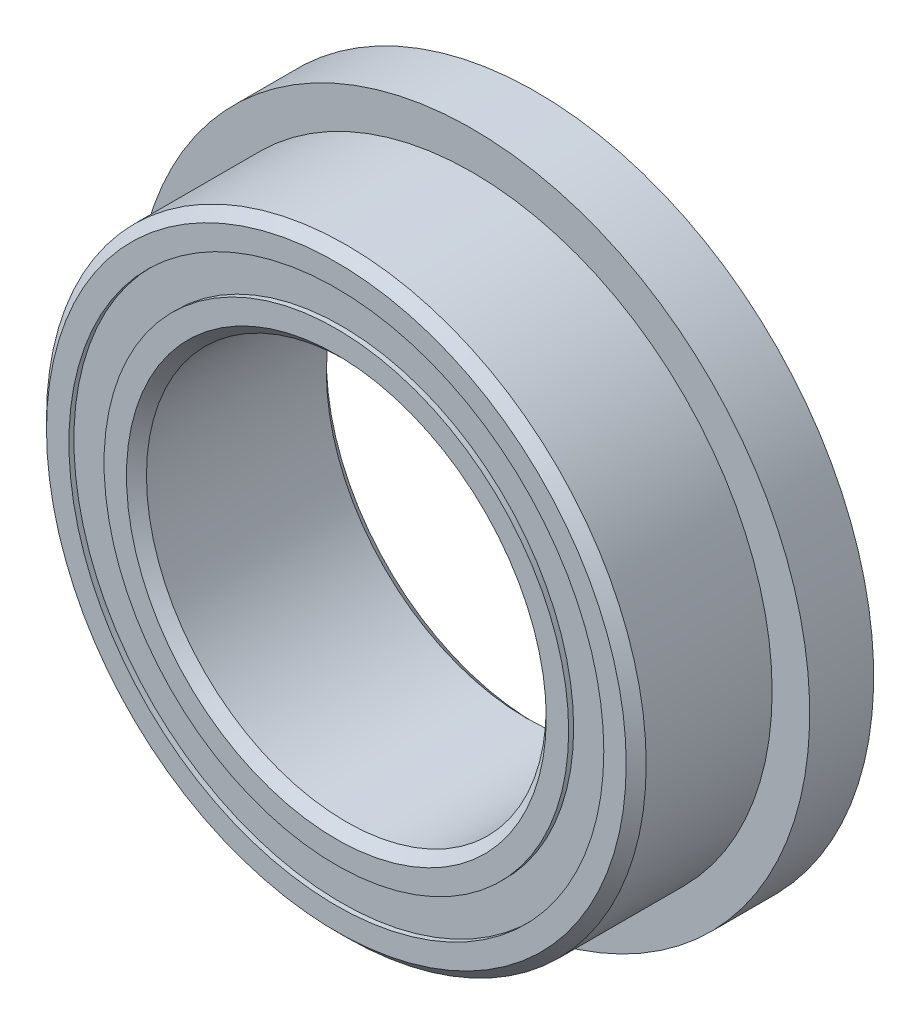
from build123d import *

# Parameters (mm, degrees)
CIRPATTERN1_COUNT = 14
SKETCH5_W         = 0.749364756
SKETCH5_H         = 0.558241758
SKETCH6_W         = 1.016
SKETCH6_H         = 1.111529121


with BuildPart() as part:
    # Sketch → Revolve1 (revolve)
    with BuildSketch(Plane(origin=(0, 0, 0), x_dir=(0, 0, -1), z_dir=(1, 0, 0))):
        with BuildLine():
            Line((1.42875, 4.7625), (-1.42875, 4.7625))
            Line((-1.42875, 4.7625), (-1.5875, 4.60375))
            Line((-1.5875, 4.60375), (-1.5875, 4.247870879))
            Line((-1.5875, 4.247870879), (-0.705555556, 4.247870879))
            ThreePointArc((-0.705555556, 4.247870879), (0, 4.727510244), (0.705555556, 4.247870879))
            Line((0.705555556, 4.247870879), (1.5875, 4.247870879))
            Line((1.5875, 4.247870879), (1.5875, 4.60375))
            Line((1.5875, 4.60375), (1.42875, 4.7625))
        make_face()
    revolve(axis=Axis((0, 0, 1.5875), (0, 0, -1)))

    # Sketch6 → Revolve6 (revolve)
    with BuildSketch(Plane(origin=(0, 0, 0), x_dir=(0, 0, -1), z_dir=(1, 0, 0))):
        with Locations((1.0795, 4.80363544)):
            Rectangle(SKETCH6_W, SKETCH6_H)
    revolve(axis=Axis((0, 0, -1.5875), (0, 0, 1)))


with BuildPart() as body_2:
    # Sketch3 → Revolve3 (revolve)
    with BuildSketch(Plane(origin=(0, 0, 0), x_dir=(0, 0, -1), z_dir=(1, 0, 0))):
        with BuildLine():
            Line((-1.5875, 3.689629121), (-0.705555556, 3.689629121))
            ThreePointArc((-0.705555556, 3.689629121), (0, 3.209989756), (0.705555556, 3.689629121))
            Line((0.705555556, 3.689629121), (1.5875, 3.689629121))
            Line((1.5875, 3.689629121), (1.5875, 3.33375))
            Line((1.5875, 3.33375), (1.42875, 3.175))
            Line((1.42875, 3.175), (-1.42875, 3.175))
            Line((-1.42875, 3.175), (-1.5875, 3.33375))
            Line((-1.5875, 3.33375), (-1.5875, 3.689629121))
        make_face()
    revolve(axis=Axis((0, 0, 1.5875), (0, 0, -1)))


with BuildPart() as body_3:
    # Sketch4 → Revolve4 (revolve)
    with BuildSketch(Plane(origin=(0, 0, 0), x_dir=(0, 0, -1), z_dir=(1, 0, 0))):
        with BuildLine():
            Line((-0.758760244, 3.96875), (0.758760244, 3.96875))
            ThreePointArc((0.758760244, 3.96875), (0, 4.727510244), (-0.758760244, 3.96875))
        make_face()
    revolve(axis=Axis((0, 3.96875, 0.758760244), (0, 0, -1)))


with BuildPart() as cirpattern1_1:
    # CirPattern1: pattern copy
    add(body_3.part.rotate(Axis((0, 0, -1.5875), (0, 0, 1)), 1 * 360 / CIRPATTERN1_COUNT))


with BuildPart() as cirpattern1_2:
    # CirPattern1: pattern copy
    add(body_3.part.rotate(Axis((0, 0, -1.5875), (0, 0, 1)), 2 * 360 / CIRPATTERN1_COUNT))


with BuildPart() as cirpattern1_3:
    # CirPattern1: pattern copy
    add(body_3.part.rotate(Axis((0, 0, -1.5875), (0, 0, 1)), 3 * 360 / CIRPATTERN1_COUNT))


with BuildPart() as cirpattern1_4:
    # CirPattern1: pattern copy
    add(body_3.part.rotate(Axis((0, 0, -1.5875), (0, 0, 1)), 4 * 360 / CIRPATTERN1_COUNT))


with BuildPart() as cirpattern1_5:
    # CirPattern1: pattern copy
    add(body_3.part.rotate(Axis((0, 0, -1.5875), (0, 0, 1)), 5 * 360 / CIRPATTERN1_COUNT))


with BuildPart() as cirpattern1_6:
    # CirPattern1: pattern copy
    add(body_3.part.rotate(Axis((0, 0, -1.5875), (0, 0, 1)), 6 * 360 / CIRPATTERN1_COUNT))


with BuildPart() as cirpattern1_7:
    # CirPattern1: pattern copy
    add(body_3.part.rotate(Axis((0, 0, -1.5875), (0, 0, 1)), 7 * 360 / CIRPATTERN1_COUNT))


with BuildPart() as cirpattern1_8:
    # CirPattern1: pattern copy
    add(body_3.part.rotate(Axis((0, 0, -1.5875), (0, 0, 1)), 8 * 360 / CIRPATTERN1_COUNT))


with BuildPart() as cirpattern1_9:
    # CirPattern1: pattern copy
    add(body_3.part.rotate(Axis((0, 0, -1.5875), (0, 0, 1)), 9 * 360 / CIRPATTERN1_COUNT))


with BuildPart() as cirpattern1_10:
    # CirPattern1: pattern copy
    add(body_3.part.rotate(Axis((0, 0, -1.5875), (0, 0, 1)), 10 * 360 / CIRPATTERN1_COUNT))


with BuildPart() as cirpattern1_11:
    # CirPattern1: pattern copy
    add(body_3.part.rotate(Axis((0, 0, -1.5875), (0, 0, 1)), 11 * 360 / CIRPATTERN1_COUNT))


with BuildPart() as cirpattern1_12:
    # CirPattern1: pattern copy
    add(body_3.part.rotate(Axis((0, 0, -1.5875), (0, 0, 1)), 12 * 360 / CIRPATTERN1_COUNT))


with BuildPart() as cirpattern1_13:
    # CirPattern1: pattern copy
    add(body_3.part.rotate(Axis((0, 0, -1.5875), (0, 0, 1)), 13 * 360 / CIRPATTERN1_COUNT))


with BuildPart() as body_17:
    # Sketch5 → Revolve5 (revolve)
    with BuildSketch(Plane(origin=(0, 0, 0), x_dir=(0, 0, -1), z_dir=(1, 0, 0))):
        with Locations((-1.133442622, 3.96875)):
            Rectangle(SKETCH5_W, SKETCH5_H)
        with Locations((1.133442622, 3.96875)):
            Rectangle(SKETCH5_W, SKETCH5_H)
    revolve(axis=Axis((0, 0, 1.5875), (0, 0, -1)))


solid = Compound([part.part, body_2.part, body_3.part, cirpattern1_1.part, cirpattern1_2.part, cirpattern1_3.part, cirpattern1_4.part, cirpattern1_5.part, cirpattern1_6.part, cirpattern1_7.part, cirpattern1_8.part, cirpattern1_9.part, cirpattern1_10.part, cirpattern1_11.part, cirpattern1_12.part, cirpattern1_13.part, body_17.part])
